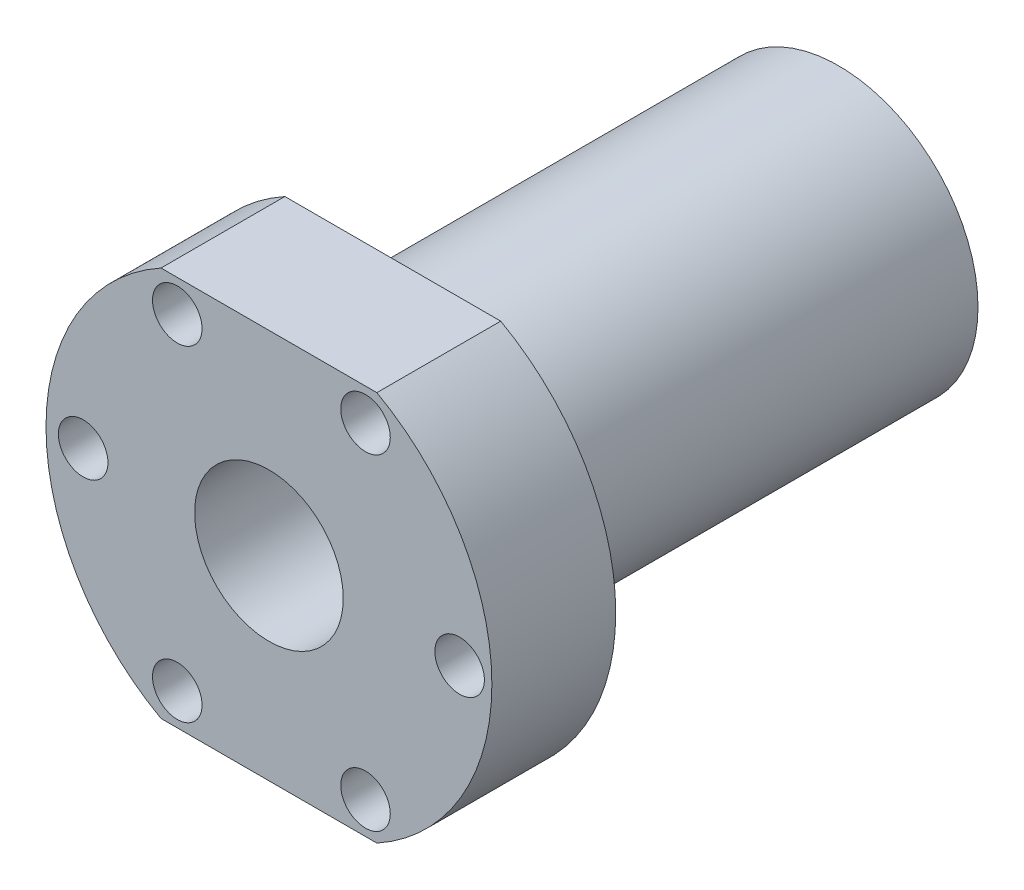
from build123d import *

# Parameters (mm, degrees)
SALIENTE_EXTRUIR1_DEPTH = 10
CROQUIS2_R              = 2
CORTAR_EXTRUIR1_DEPTH   = 18
MATRIZC1_COUNT          = 6
CROQUIS4_R              = 11.25
SALIENTE_EXTRUIR2_DEPTH = 36
CROQUIS5_R              = 6
CORTAR_EXTRUIR2_DEPTH   = 53


with BuildPart() as part:
    # Croquis1 → Saliente-Extruir1 (new body)
    with BuildSketch(Plane.XY):
        with BuildLine():
            Line((-8.714212529, -15.75), (8.714212529, -15.75))
            ThreePointArc((8.714212529, -15.75), (18, 0), (8.714212529, 15.75))
            Line((8.714212529, 15.75), (-8.714212529, 15.75))
            ThreePointArc((-8.714212529, 15.75), (-18, 0), (-8.714212529, -15.75))
        make_face()
    extrude(amount=SALIENTE_EXTRUIR1_DEPTH)

    # Croquis2 → Cortar-Extruir1 (cut)
    with BuildSketch(Plane.XY.offset(10)):
        with Locations((-15, 0)):
            Circle(CROQUIS2_R)
    cortar_extruir1 = extrude(amount=-CORTAR_EXTRUIR1_DEPTH, mode=Mode.SUBTRACT)

    # MatrizC1: Cortar-Extruir1 ×6 about axis
    matrizc1_axis = Axis((0.197930151, 0, 10), (0, 0, 1))
    for i in range(1, MATRIZC1_COUNT):
        add(cortar_extruir1.rotate(matrizc1_axis, i * 360 / MATRIZC1_COUNT), mode=Mode.SUBTRACT)

    # Croquis4 → Saliente-Extruir2 (add)
    with BuildSketch(Plane(origin=(0, 0, 0), x_dir=(-1, 0, 0), z_dir=(0, 0, -1))):
        Circle(CROQUIS4_R)
    extrude(amount=SALIENTE_EXTRUIR2_DEPTH)

    # Croquis5 → Cortar-Extruir2 (cut)
    with BuildSketch(Plane.XY.offset(10)):
        Circle(CROQUIS5_R)
    extrude(amount=-CORTAR_EXTRUIR2_DEPTH, mode=Mode.SUBTRACT)


solid = part.part
